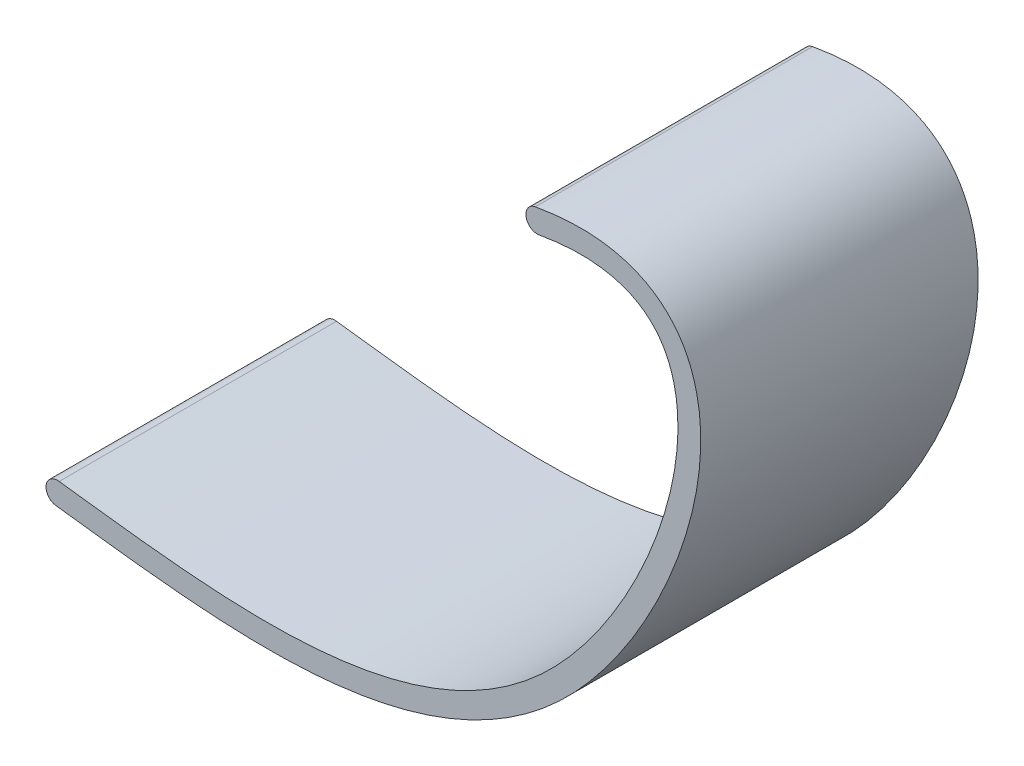
from build123d import *

# Parameters (mm, degrees)
BOSS_EXTRUDE1_DEPTH = 38.6715


with BuildPart() as part:
    # Sketch1 → Boss-Extrude1 (new body)
    with BuildSketch(Plane.XY):
        with BuildLine():
            ThreePointArc((10.006396646, -8.723671201), (9.6856926, -8.817157065), (9.3918086, -8.975974215))
            ThreePointArc((9.3918086, -8.975974215), (8.820193634, -10.887430895), (10.567548963, -11.850322197))
            add(Edge.make_bspline(
                [(10.567548963, -11.850322197), (11.064269525, -11.761093941), (12.080491031, -11.597711964), (13.968208449, -11.370890598), (16.166895654, -11.249689832), (18.518865702, -11.350999734), (21.295539399, -11.785443232), (24.11167936, -12.834689857), (26.601697124, -14.755146671), (28.379995149, -17.306824059), (29.88808226, -21.563107583), (30.136251325, -28.328727621), (27.999683445, -37.790920326), (23.849398525, -47.611280488), (18.141683263, -56.886862416), (11.393951321, -64.665002775), (4.036208166, -70.261276273), (-6.519406974, -75.378809609), (-17.988843971, -77.495074443), (-29.876715905, -77.681570234), (-38.856275975, -77.125905714), (-46.266639397, -76.316170507), (-52.099298623, -75.599236123), (-54.942427292, -75.245126778), (-56.373615377, -75.071400023)],
                knots=[0, 0, 0, 0, 0.0078125, 0.015625, 0.03125, 0.046875, 0.0625, 0.09375, 0.125, 0.15625, 0.1875, 0.25, 0.3125, 0.375, 0.4375, 0.5, 0.5625, 0.625, 0.75, 0.8125, 0.875, 0.9375, 0.96875, 1, 1, 1, 1], degree=3))
            ThreePointArc((-56.373615377, -75.071400023), (-58.192038859, -76.448973664), (-56.756006052, -78.221594006))
            add(Edge.make_bspline(
                [(10.006396646, -8.723671201), (10.54242797, -8.627381367), (11.635392855, -8.451629955), (13.694652207, -8.203872504), (16.131840762, -8.068239533), (18.815951799, -8.181631742), (22.093600209, -8.690579894), (25.632324508, -9.987194236), (28.945689239, -12.53202555), (31.262016086, -15.88059677), (32.633446772, -19.807046415), (33.177135985, -24.161221136), (32.935005387, -30.402749506), (31.025488793, -38.80010345), (26.678195112, -49.075698309), (20.729339942, -58.748668337), (13.601956626, -66.975747854), (5.710101164, -72.984560006), (-2.764546281, -77.088482339), (-11.640393326, -79.56136318), (-20.755710578, -80.71498899), (-29.966848039, -80.856582063), (-39.142308664, -80.287403052), (-46.636575149, -79.46790651), (-52.494786743, -78.747820748), (-55.327228894, -78.395028107), (-56.756006052, -78.221594006)],
                knots=[0, 0, 0, 0, 0.0078125, 0.015625, 0.03125, 0.046875, 0.0625, 0.09375, 0.125, 0.15625, 0.1875, 0.21875, 0.25, 0.3125, 0.375, 0.4375, 0.5, 0.5625, 0.625, 0.6875, 0.75, 0.8125, 0.875, 0.9375, 0.96875, 1, 1, 1, 1], degree=3))
        make_face()
    extrude(amount=BOSS_EXTRUDE1_DEPTH)


solid = part.part
